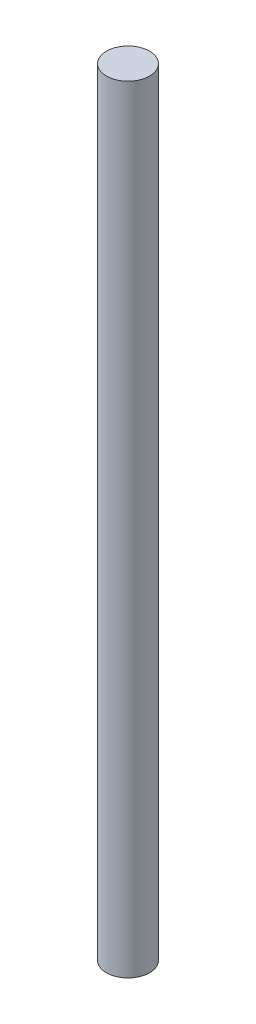
from build123d import *

# Parameters (mm, degrees)
SKETCH_1_R      = 2.5
EXTRUDE_1_DEPTH = 90


with BuildPart() as part:
    # 草图1 → 凸台-拉伸1 (new body)
    with BuildSketch(Plane(origin=(0, 0, 0), x_dir=(1, 0, 0), z_dir=(0, 1, 0))):
        with Locations(Location((0, 0, 0), (0, 0, 90))):
            Circle(SKETCH_1_R)
    extrude(amount=EXTRUDE_1_DEPTH)


solid = part.part
